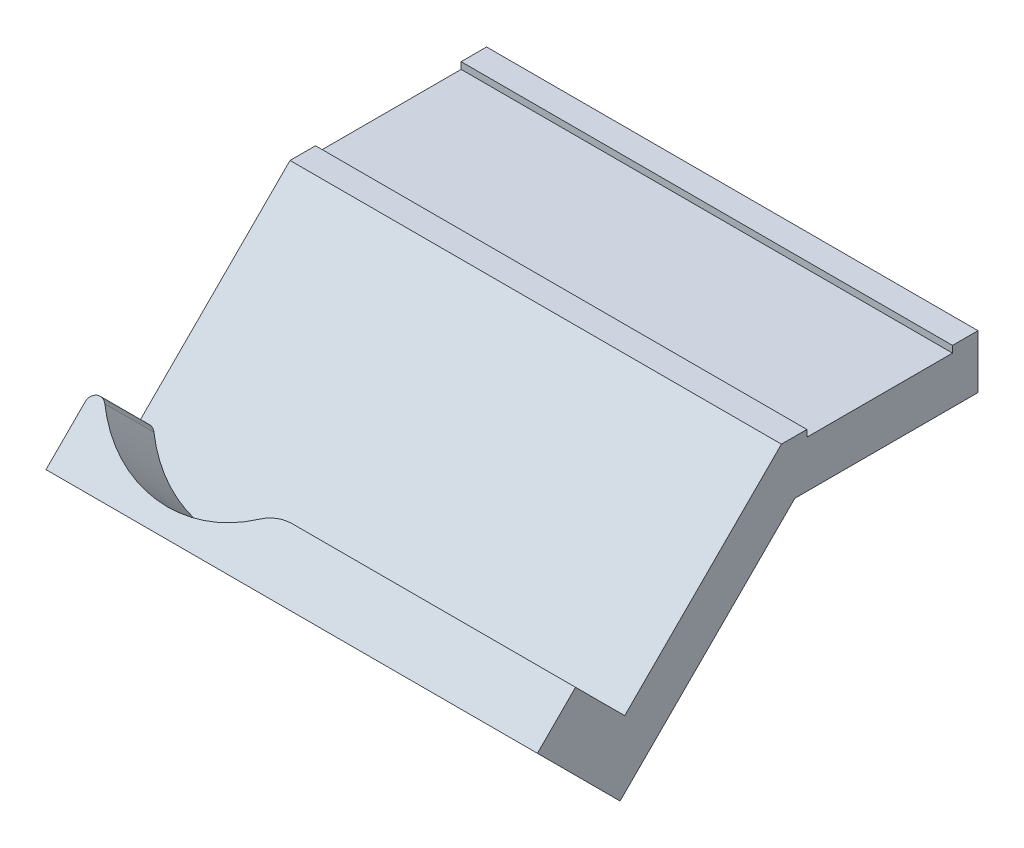
from build123d import *

# Parameters (mm, degrees)
SKETCH1_W           = 55
SKETCH1_H           = 30.75
BOSS_EXTRUDE1_DEPTH = 50
CUT_EXTRUDE1_DEPTH  = 50
CUT_EXTRUDE2_DEPTH  = 81.439806688
BOSS_EXTRUDE2_REACH = 82.44
SKETCH6_R           = 13.75
CUT_EXTRUDE3_DEPTH  = 81.212608111
CUT_EXTRUDE4_DEPTH  = 81.439806688
SKETCH8_R           = 6
CUT_EXTRUDE5_DEPTH  = 72.014963212
CUT_EXTRUDE6_DEPTH  = 72.014963212
SKETCH10_W          = 55
SKETCH10_H          = 4.5
CUT_EXTRUDE7_DEPTH  = 70.055231518
FILLET5_R           = 1
FILLET6_R           = 5
CUT_EXTRUDE8_DEPTH  = 68.172352944
SKETCH17_W          = 55
SKETCH17_H          = 6
BOSS_EXTRUDE4_DEPTH = 22
BOSS_EXTRUDE5_DEPTH = 55
SKETCH19_W          = 55
SKETCH19_H          = 16.3
CUT_EXTRUDE9_DEPTH  = 0.75
BOSS_EXTRUDE6_DEPTH = 55


with BuildPart() as part:
    # Sketch1 → Boss-Extrude1 (new body)
    with BuildSketch(Plane(origin=(0, 0, 0), x_dir=(1, 0, 0), z_dir=(0, 1, 0))):
        with Locations((27.5, 15.375)):
            Rectangle(SKETCH1_W, SKETCH1_H)
    extrude(amount=BOSS_EXTRUDE1_DEPTH)

    # Sketch4 → Cut-Extrude1 (cut)
    with BuildSketch(Plane(origin=(55, 0, 0), x_dir=(0, 0, -1), z_dir=(1, 0, 0))):
        Polygon((-27.355339059, 45.355339059), (8, 80.710678119), (43.355339059, 45.355339059), (8, 10), align=None)
    extrude(amount=-CUT_EXTRUDE1_DEPTH, mode=Mode.SUBTRACT)

    # Sketch5 → Cut-Extrude2 (cut, through all)
    with BuildSketch(Plane(origin=(55, 0, 0), x_dir=(0, 0, -1), z_dir=(1, 0, 0))):
        Polygon((-11.642135624, 15.5), (-4.571067812, 22.571067812), (2.5, 15.5), (-4.571067812, 8.428932188), align=None)
    extrude(amount=-CUT_EXTRUDE2_DEPTH, mode=Mode.SUBTRACT)

    # Sketch12 → Boss-Extrude2 (add, up to next)
    with BuildSketch(Plane(origin=(55, 0, 0), x_dir=(0, 0, -1), z_dir=(1, 0, 0)), mode=Mode.PRIVATE) as boss_extrude2_sk1:
        Polygon((2.5, 15.5), (8, 10), (8.707106781, 10.707106781), (3.207106781, 16.207106781), align=None)
    boss_extrude2_tool1 = extrude(boss_extrude2_sk1.sketch, amount=-BOSS_EXTRUDE2_REACH, mode=Mode.PRIVATE) - part.part
    add(boss_extrude2_tool1.solids().sort_by_distance((55, 13.103553, -5.603553))[0])

    # Sketch6 → Cut-Extrude3 (cut, through all)
    with BuildSketch(Plane(origin=(0, 1, 1), x_dir=(1, 0, 0), z_dir=(0, 0.7071067811865515, 0.7071067811865436))):
        with Locations((12, 23.692388155)):
            Circle(SKETCH6_R)
    extrude(amount=CUT_EXTRUDE3_DEPTH, mode=Mode.SUBTRACT)

    # Sketch7 → Cut-Extrude4 (cut, through all)
    with BuildSketch(Plane(origin=(55, 0, 0), x_dir=(0, 0, -1), z_dir=(1, 0, 0))):
        Polygon((0, 13), (5.506338941, 18.506338941), (11.006338941, 13.006338941), (61, 63), (25.408423261, 63), (0, 63), align=None)
    extrude(amount=-CUT_EXTRUDE4_DEPTH, mode=Mode.SUBTRACT)

    # Sketch8 → Cut-Extrude5 (cut, through all)
    with BuildSketch(Plane(origin=(0, 0, 0), x_dir=(1, 0, 0), z_dir=(0, 1, 0))):
        with Locations((25.75, 32.25)):
            Circle(SKETCH8_R)
    extrude(amount=CUT_EXTRUDE5_DEPTH, mode=Mode.SUBTRACT)

    # Sketch9 → Cut-Extrude6 (cut, through all)
    with BuildSketch(Plane(origin=(55, 0, 0), x_dir=(0, 0, -1), z_dir=(1, 0, 0))):
        Polygon((26.25, 28.25), (30.75, 28.25), (30.75, 32.75), align=None)
    extrude(amount=-CUT_EXTRUDE6_DEPTH, mode=Mode.SUBTRACT)

    # Sketch10 → Cut-Extrude7 (cut, through all)
    with BuildSketch(Plane(origin=(0, 0, 0), x_dir=(1, 0, 0), z_dir=(0, 1, 0))):
        with Locations((27.5, 28.5)):
            Rectangle(SKETCH10_W, SKETCH10_H)
    extrude(amount=CUT_EXTRUDE7_DEPTH, mode=Mode.SUBTRACT)

    # Fillet5
    fillet5_edges = [part.edges().sort_by_distance(p)[0] for p in [
        (0, 15.756338941, -8.256338941),
    ]]
    fillet(fillet5_edges, radius=FILLET5_R)

    # Fillet6
    fillet6_edges = [part.edges().sort_by_distance(p)[0] for p in [
        (21.474804244, 13.457106781, -5.957106781),
    ]]
    fillet(fillet6_edges, radius=FILLET6_R)

    # Sketch16 → Cut-Extrude8 (cut, through all)
    with BuildSketch(Plane(origin=(55, 0, 0), x_dir=(0, 0, -1), z_dir=(1, 0, 0))):
        Polygon((26.25, 20.75), (9.25, 3.75), (0, 13), (0, 0), (26.25, 0), align=None)
    extrude(amount=-CUT_EXTRUDE8_DEPTH, mode=Mode.SUBTRACT)

    # Sketch17 → Boss-Extrude4 (add)
    with BuildSketch(Plane(origin=(0, 0, -26.25), x_dir=(-1, 0, 0), z_dir=(0, 0, -1))):
        with Locations((-27.5, 25.25)):
            Rectangle(SKETCH17_W, SKETCH17_H)
    extrude(amount=BOSS_EXTRUDE4_DEPTH)

    # Sketch18 → Boss-Extrude5 (add)
    with BuildSketch(Plane(origin=(55, 0, 0), x_dir=(0, 0, -1), z_dir=(1, 0, 0))):
        Polygon((17.75, 12.25), (33.75, 28.25), (26.25, 28.25), (14, 16), align=None)
    extrude(amount=-BOSS_EXTRUDE5_DEPTH)

    # Sketch19 → Cut-Extrude9 (cut)
    with BuildSketch(Plane(origin=(0, 28.25, 0), x_dir=(1, 0, 0), z_dir=(0, 1, 0))):
        with Locations((27.5, 37.25)):
            Rectangle(SKETCH19_W, SKETCH19_H)
    extrude(amount=-CUT_EXTRUDE9_DEPTH, mode=Mode.SUBTRACT)

    # Sketch20 → Boss-Extrude6 (add)
    with BuildSketch(Plane(origin=(55, 0, 0), x_dir=(0, 0, -1), z_dir=(1, 0, 0))):
        Polygon((0, 13), (-1.060660172, 11.939339828), (8.189339828, 2.689339828), (9.25, 3.75), align=None)
    extrude(amount=-BOSS_EXTRUDE6_DEPTH)


solid = part.part
